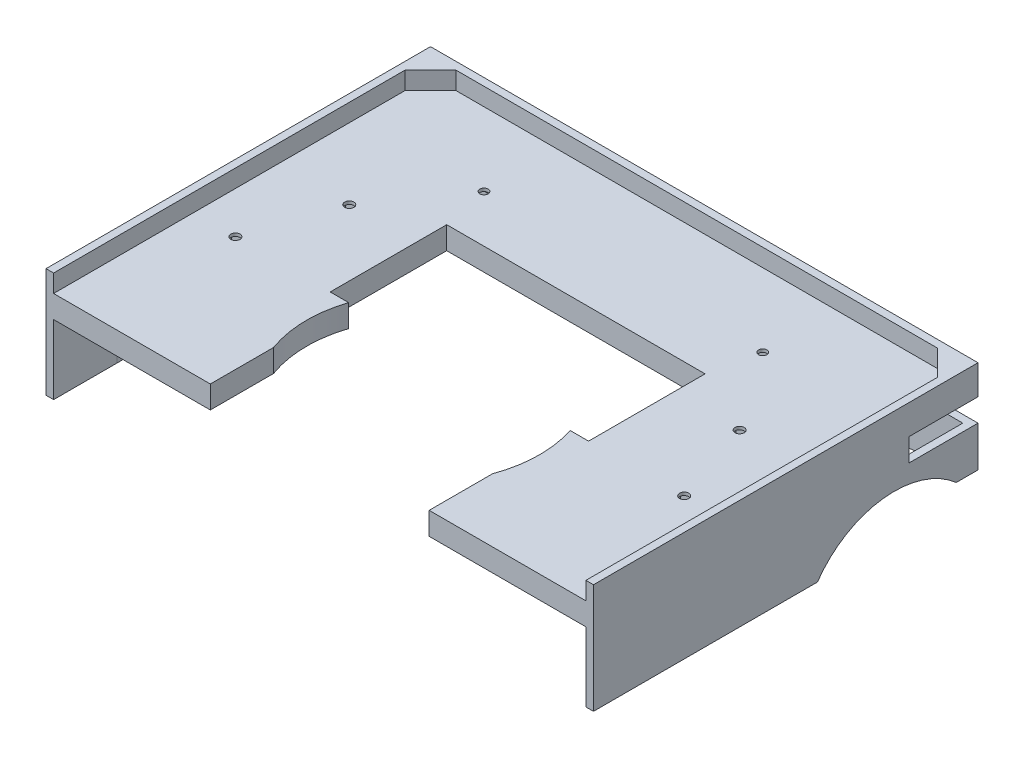
from build123d import *

# Parameters (mm, degrees)
CROQUIS1_W              = 216.14
CROQUIS1_H              = 126.8
SALIENTE_EXTRUIR1_DEPTH = 15.9
CROQUIS5_W              = 210.14
CROQUIS5_H              = 120.8
CORTAR_EXTRUIR2_DEPTH   = 7
CROQUIS3_R              = 46
CORTAR_EXTRUIR1_DEPTH   = 252.092711165
CROQUIS6_R              = 1.825
CROQUIS6_R_2            = 1.65
CORTAR_EXTRUIR3_DEPTH   = 252.092711165
SALIENTE_EXTRUIR2_DEPTH = 27.4
CORTAR_EXTRUIR4_DEPTH   = 253.082327028
CORTAR_EXTRUIR5_DEPTH   = 10
SALIENTE_EXTRUIR3_REACH = 254.082
SALIENTE_EXTRUIR4_DEPTH = 25
CROQUIS13_W             = 61.875090743
CROQUIS13_H             = 28
CORTAR_EXTRUIR7_DEPTH   = 7
CROQUIS16_W             = 12
CROQUIS16_H             = 9
CROQUIS16_W_2           = 16
CROQUIS16_H_2           = 13
CORTAR_EXTRUIR8_DEPTH   = 7.7
CHAFL_N1_SIZE           = 10
CROQUIS21_W             = 102
CROQUIS21_H             = 46
CORTAR_EXTRUIR10_DEPTH  = 253.608539048
CORTAR_EXTRUIR11_REACH  = 268.038
CROQUIS23_W             = 27.206677637
CROQUIS23_H             = 8.999999982
CORTAR_EXTRUIR12_DEPTH  = 253.607680361
CROQUIS25_W             = 24.206677637
CROQUIS25_H             = 4.236354688
CORTAR_EXTRUIR16_DEPTH  = 50
CROQUIS26_W             = 24.206677637
CROQUIS26_H             = 4.25
CORTAR_EXTRUIR17_DEPTH  = 50
CROQUIS31_W             = 20.435797251
CROQUIS31_H             = 32.708240737
CORTAR_EXTRUIR19_DEPTH  = 4.25
CORTAR_EXTRUIR20_REACH  = 255.179
CROQUIS32_W             = 39.355076343
CROQUIS32_H             = 27.206677637


with BuildPart() as part:
    # Croquis1 → Saliente-Extruir1 (new body)
    with BuildSketch(Plane(origin=(0, 0, 0), x_dir=(1, 0, 0), z_dir=(0, 1, 0))):
        with Locations((108.07, 63.4)):
            Rectangle(CROQUIS1_W, CROQUIS1_H)
    extrude(amount=SALIENTE_EXTRUIR1_DEPTH)

    # Croquis5 → Cortar-Extruir2 (cut)
    with BuildSketch(Plane(origin=(0, 15.9, 0), x_dir=(1, 0, 0), z_dir=(0, 1, 0))):
        with Locations((108.07, 63.4)):
            Rectangle(CROQUIS5_W, CROQUIS5_H)
    extrude(amount=-CORTAR_EXTRUIR2_DEPTH, mode=Mode.SUBTRACT)

    # Croquis3 → Cortar-Extruir1 (cut, through all)
    with BuildSketch(Plane(origin=(0, 15.9, 0), x_dir=(1, 0, 0), z_dir=(0, 1, 0))):
        with Locations((108.07, 15.808005153)):
            Circle(CROQUIS3_R)
    extrude(amount=-CORTAR_EXTRUIR1_DEPTH, mode=Mode.SUBTRACT)

    # Croquis6 → Cortar-Extruir3 (cut, through all)
    with BuildSketch(Plane(origin=(0, 0, 0), x_dir=(-1, 0, 0), z_dir=(0, -1, 0))):
        with Locations(Location((-196.658016439, 30.303322363, 0), (0, 0, 90))):
            Circle(CROQUIS6_R)
        with Locations(Location((-185.122851299, 63.713322363, 0), (0, 0, 90))):
            Circle(CROQUIS6_R)
        with Locations(Location((-31.017148701, 63.713322363, 0), (0, 0, 270))):
            Circle(CROQUIS6_R)
        with Locations(Location((-19.481983561, 30.303322363, 0), (0, 0, 270))):
            Circle(CROQUIS6_R)
        with Locations(Location((-53.066508219, 94.858322363, 0), (0, 0, 90))):
            Circle(CROQUIS6_R_2)
        with Locations(Location((-163.073491781, 94.858322363, 0), (0, 0, 270))):
            Circle(CROQUIS6_R_2)
    extrude(amount=-CORTAR_EXTRUIR3_DEPTH, mode=Mode.SUBTRACT)

    # Croquis7 → Saliente-Extruir2 (add)
    with BuildSketch(Plane.XZ):
        Polygon((216.14, 0), (213.14, 0), (213.14, -123.8), (3, -123.8), (3, 0), (0, 0), (0, -126.8), (216.14, -126.8), align=None)
    extrude(amount=SALIENTE_EXTRUIR2_DEPTH)

    # Croquis8 → Cortar-Extruir4 (cut, through all)
    with BuildSketch(Plane(origin=(216.14, 0, 0), x_dir=(0, 0, -1), z_dir=(1, 0, 0))):
        with BuildLine():
            Line((124.134269168, -27.4), (63.4, -27.4))
            ThreePointArc((63.4, -27.4), (93.767134584, -11.538522587), (124.134269168, -27.4))
        make_face()
    extrude(amount=-CORTAR_EXTRUIR4_DEPTH, mode=Mode.SUBTRACT)

    # Croquis9 → Cortar-Extruir5 (cut)
    with BuildSketch(Plane(origin=(0, 0, -126.8), x_dir=(-1, 0, 0), z_dir=(0, 0, -1))):
        Polygon((-216.14, -20.764005722), (-166.027655823, -27.4), (-216.14, -27.4), align=None)
        Polygon((-50.112344177, -27.4), (0, -27.4), (0, -20.764005722), align=None)
    extrude(amount=-CORTAR_EXTRUIR5_DEPTH, mode=Mode.SUBTRACT)

    # Saliente-Extruir3: up to this face of the body (flat: up to its plane)
    saliente_extruir3_end = Plane(part.part.faces().sort_by_distance((108.07, -12.927901237, -123.8))[0])
    # Croquis10 → Saliente-Extruir3 (add, up to the picked face)
    with BuildSketch(Plane(origin=(0, 0, -126.8), x_dir=(-1, 0, 0), z_dir=(0, 0, -1)), mode=Mode.PRIVATE) as saliente_extruir3_sk1:
        Polygon((-166.027655823, -27.4), (-132.196508219, -31.88), (-83.946508219, -31.88), (-50.112344177, -27.4), align=None)
    saliente_extruir3_tool1 = split(extrude(saliente_extruir3_sk1.sketch, amount=-SALIENTE_EXTRUIR3_REACH, mode=Mode.PRIVATE), bisect_by=saliente_extruir3_end, keep=Keep.BOTH, mode=Mode.PRIVATE)
    add(saliente_extruir3_tool1.solids().sort_by(Axis((108.070651, -29.332241, -126.8), (0, 0, 1)))[0])

    # Croquis11 → Saliente-Extruir4 (add)
    with BuildSketch(Plane.XY):
        Polygon((151.268460309, 15.9), (151.268460309, 0), (213.14, 0), (213.14, -27.4), (216.14, -27.4), (216.14, 15.9), align=None)
        Polygon((0.003551053, -27.4), (0.003551053, 15.9), (64.875090743, 15.9), (64.875090743, 0), (3.003551053, 0), (3.003551053, -27.4), align=None)
    extrude(amount=SALIENTE_EXTRUIR4_DEPTH)

    # Croquis13 → Cortar-Extruir7 (cut)
    with BuildSketch(Plane(origin=(0, 15.9, 0), x_dir=(1, 0, 0), z_dir=(0, 1, 0))):
        with Locations((33.937545372, -11)):
            Rectangle(CROQUIS13_W, CROQUIS13_H)
        with Locations((182.202454628, -11)):
            Rectangle(CROQUIS13_W, CROQUIS13_H)
    extrude(amount=-CORTAR_EXTRUIR7_DEPTH, mode=Mode.SUBTRACT)

    # Croquis16 → Cortar-Extruir8 (cut)
    with BuildSketch(Plane.XZ):
        with Locations((31.02016514, -63.713322363)):
            Rectangle(CROQUIS16_W, CROQUIS16_H)
        with Locations((19.485, -30.303322363)):
            Rectangle(CROQUIS16_W_2, CROQUIS16_H_2)
        Polygon((186.575628008, -82.591759265), (186.575966494, -99.591759262), (156.5759665, -99.592356589), (156.575777943, -90.122356591), (167.575777941, -90.122137571), (167.575628012, -82.592137572), align=None)
        Polygon((191.121505569, -59.211668748), (191.121684768, -68.211668746), (179.12168477, -68.211907677), (179.121505572, -59.211907679), align=None)
        Polygon((204.656224503, -36.801399255), (188.656224506, -36.801717829), (188.655965664, -23.801717832), (204.655965661, -23.801399257), align=None)
        Polygon((29.566508219, -99.593322363), (59.566508219, -99.593322363), (59.566508219, -90.123322363), (48.566508219, -90.123322363), (48.566508219, -82.593322363), (29.566508219, -82.593322363), align=None)
    extrude(amount=-CORTAR_EXTRUIR8_DEPTH, mode=Mode.SUBTRACT)

    # Chaflán1
    chafl_n1_edges = [part.edges().sort_by_distance(p)[0] for p in [
        (3, 12.4, -123.8),
        (213.14, 12.4, -123.8),
    ]]
    chamfer(chafl_n1_edges, length=CHAFL_N1_SIZE)

    # Croquis21 → Cortar-Extruir10 (cut, through all)
    with BuildSketch(Plane.XZ):
        with Locations((108.071569823, -53.123322363)):
            Rectangle(CROQUIS21_W, CROQUIS21_H)
    extrude(amount=-CORTAR_EXTRUIR10_DEPTH, mode=Mode.SUBTRACT)

    # Cortar-Extruir11: up to this face of the body (flat: up to its plane)
    cortar_extruir11_end = Plane(part.part.faces().sort_by_distance((44.566508219, 3.85, -99.593322363))[0])
    # Croquis22 → Cortar-Extruir11 (cut, up to the picked face)
    with BuildSketch(Plane(origin=(0, 0, -126.8), x_dir=(-1, 0, 0), z_dir=(0, 0, -1)), mode=Mode.PRIVATE) as cortar_extruir11_sk1:
        with BuildLine():
            Line((-177.076508219, 4.25), (-216.14, 4.25))
            Line((-216.14, 4.25), (-216.14, -4.75))
            Line((-216.14, -4.75), (-177.076508219, -4.75))
            ThreePointArc((-177.076508219, -4.75), (-172.576508219, -0.25), (-177.076508219, 4.25))
        make_face()
    cortar_extruir11_tool1 = split(extrude(cortar_extruir11_sk1.sketch, amount=-CORTAR_EXTRUIR11_REACH, mode=Mode.PRIVATE), bisect_by=cortar_extruir11_end, keep=Keep.BOTH, mode=Mode.PRIVATE)
    # Croquis22 → Cortar-Extruir11 (cut, up to the picked face)
    with BuildSketch(Plane(origin=(0, 0, -126.8), x_dir=(-1, 0, 0), z_dir=(0, 0, -1)), mode=Mode.PRIVATE) as cortar_extruir11_sk2:
        with BuildLine():
            Line((-0.001303888, -4.756822615), (-39.06479559, -4.754356466))
            ThreePointArc((-39.06479559, -4.754356466), (-43.564511488, -0.254072381), (-39.064227404, 4.245643517))
            Line((-39.064227404, 4.245643517), (-0.000735701, 4.243177367))
            Line((-0.000735701, 4.243177367), (-0.001303888, -4.756822615))
        make_face()
    cortar_extruir11_tool2 = split(extrude(cortar_extruir11_sk2.sketch, amount=-CORTAR_EXTRUIR11_REACH, mode=Mode.PRIVATE), bisect_by=cortar_extruir11_end, keep=Keep.BOTH, mode=Mode.PRIVATE)
    add(cortar_extruir11_tool1.solids().sort_by(Axis((194.829267, -0.25, -126.8), (0, 0, 1)))[0], mode=Mode.SUBTRACT)
    add(cortar_extruir11_tool2.solids().sort_by(Axis((21.311752, -0.255477, -126.8), (0, 0, 1)))[0], mode=Mode.SUBTRACT)

    # Croquis23 → Cortar-Extruir12 (cut, through all)
    with BuildSketch(Plane(origin=(0.001003581, 6.3e-08, 0), x_dir=(0, 0, -1), z_dir=(0.9999999980071865, 6.3131823435647e-05, 0))):
        with Locations((113.196661182, -0.263645312)):
            Rectangle(CROQUIS23_W, CROQUIS23_H)
    extrude(amount=-CORTAR_EXTRUIR12_DEPTH, mode=Mode.SUBTRACT)

    # Croquis25 → Cortar-Extruir16 (cut)
    with BuildSketch(Plane.ZY):
        with Locations((-111.696661182, 2.118177344)):
            Rectangle(CROQUIS25_W, CROQUIS25_H)
    extrude(amount=-CORTAR_EXTRUIR16_DEPTH, mode=Mode.SUBTRACT)

    # Croquis26 → Cortar-Extruir17 (cut)
    with BuildSketch(Plane(origin=(216.14, 0, 0), x_dir=(0, 0, -1), z_dir=(1, 0, 0))):
        with Locations((111.696661182, 2.125)):
            Rectangle(CROQUIS26_W, CROQUIS26_H)
    extrude(amount=-CORTAR_EXTRUIR17_DEPTH, mode=Mode.SUBTRACT)

    # Croquis31 → Cortar-Extruir19 (cut)
    with BuildSketch(Plane.XZ):
        with Locations((176.357898626, -107.445879632)):
            Rectangle(CROQUIS31_W, CROQUIS31_H)
    extrude(amount=-CORTAR_EXTRUIR19_DEPTH, mode=Mode.SUBTRACT)

    # Cortar-Extruir20: up to this face of the body (flat: up to its plane)
    cortar_extruir20_end = Plane(part.part.faces().sort_by_distance((44.676749051, 4.236354688, -111.696661182))[0])
    # Croquis32 → Cortar-Extruir20 (cut, up to the picked face)
    with BuildSketch(Plane(origin=(-0.00026788, 4.243177304, 0), x_dir=(0.9999999980071865, 6.313182343619669e-05, 0), z_dir=(6.313182343619669e-05, -0.9999999980071865, 0)), mode=Mode.PRIVATE) as cortar_extruir20_sk1:
        with Locations((19.676227302, -113.196661182)):
            Rectangle(CROQUIS32_W, CROQUIS32_H)
    cortar_extruir20_tool1 = split(extrude(cortar_extruir20_sk1.sketch, amount=CORTAR_EXTRUIR20_REACH, mode=Mode.PRIVATE), bisect_by=cortar_extruir20_end, keep=Keep.BOTH, mode=Mode.PRIVATE)
    add(cortar_extruir20_tool1.solids().sort_by(Axis((19.675959, 4.244419, -113.196661), (6.313182343619669e-05, -0.9999999980071865, 0)))[0], mode=Mode.SUBTRACT)


solid = part.part
